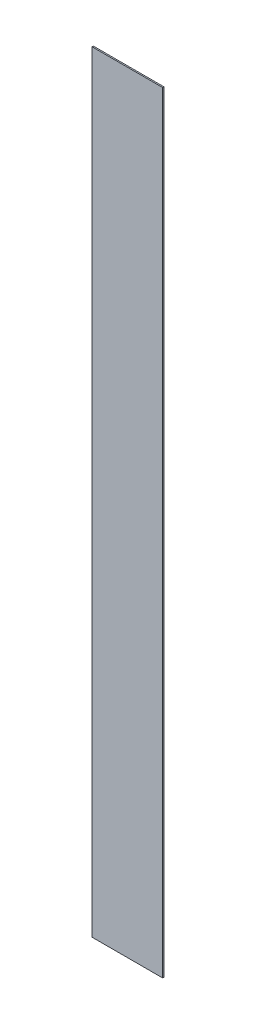
from build123d import *

# Parameters (mm, degrees)
TOPPING_SAG_KANAL_HAVA_DONUS_IZGARASI_1_START = -18
SKETCH1_W                                     = 110
SKETCH1_H                                     = 1200
TOPPING_SAG_KANAL_HAVA_DONUS_IZGARASI_1_DEPTH = 2


with BuildPart() as part:
    # Sketch1 → TOPPING_sag_kanal_hava_donus_izgarasi_1 (new body)
    with BuildSketch(Plane.XY.offset(TOPPING_SAG_KANAL_HAVA_DONUS_IZGARASI_1_START)):
        with Locations((552.5, 900)):
            Rectangle(SKETCH1_W, SKETCH1_H)
    extrude(amount=-TOPPING_SAG_KANAL_HAVA_DONUS_IZGARASI_1_DEPTH)


solid = part.part
